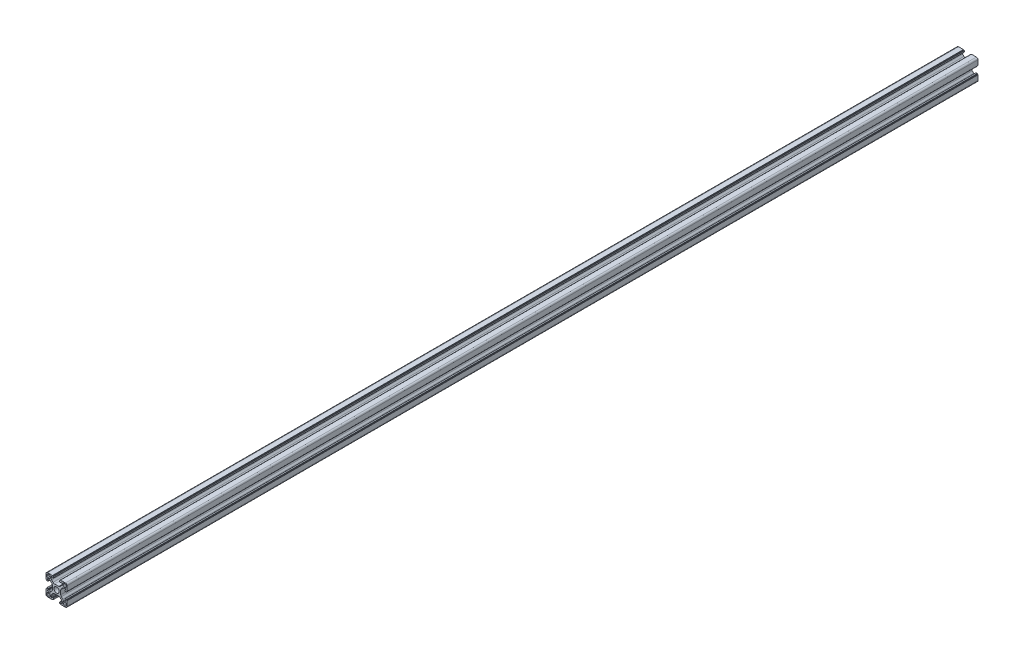
from build123d import *

# Parameters (mm, degrees)
EXTRUDE_1_DEPTH = 865


with BuildPart() as part:
    # Эскиз2 → Бобышка-Вытянуть1 (new body)
    with BuildSketch(Plane.XY):
        with BuildLine():
            Line((0.129852449, 4.683728486), (2.028633118, 4.683728486))
            ThreePointArc((2.028633118, 4.683728486), (2.793999983, 4.835969421), (3.44284668, 5.269514923))
            Line((3.44284668, 5.269514923), (4.744066011, 6.570734254))
            ThreePointArc((4.744066011, 6.570734254), (5.177611514, 7.219580952), (5.329852449, 7.984947817))
            Line((5.329852449, 7.984947817), (5.329852449, 8.883728486))
            ThreePointArc((5.329852449, 8.883728486), (5.183405839, 9.237281876), (4.829852449, 9.383728486))
            Line((4.829852449, 9.383728486), (4.72695923, 9.383728486))
            ThreePointArc((4.72695923, 9.383728486), (4.535617514, 9.345668252), (4.373405839, 9.237281876))
            Line((4.373405839, 9.237281876), (3.893075754, 8.75695179))
            ThreePointArc((3.893075754, 8.75695179), (3.811969916, 8.702758603), (3.716299058, 8.683728486))
            Line((3.716299058, 8.683728486), (3.429852449, 8.683728486))
            ThreePointArc((3.429852449, 8.683728486), (3.253075754, 8.75695179), (3.179852449, 8.933728486))
            Line((3.179852449, 8.933728486), (3.179852449, 10.082799306))
            ThreePointArc((3.179852449, 10.082799306), (3.223786432, 10.188865323), (3.329852449, 10.232799306))
            Line((3.329852449, 10.232799306), (3.829852449, 10.232799306))
            Line((3.829852449, 10.232799306), (3.829852449, 10.533728486))
            ThreePointArc((3.829852449, 10.533728486), (3.873786432, 10.639794503), (3.979852449, 10.683728486))
            Line((3.979852449, 10.683728486), (8.629852449, 10.683728486))
            ThreePointArc((8.629852449, 10.683728486), (9.690512621, 10.244388658), (10.129852449, 9.183728486))
            Line((10.129852449, 9.183728486), (10.129852449, 4.533728486))
            ThreePointArc((10.129852449, 4.533728486), (10.085918466, 4.427662469), (9.979852449, 4.383728486))
            Line((9.979852449, 4.383728486), (9.678923269, 4.383728486))
            Line((9.678923269, 4.383728486), (9.678923269, 3.883728486))
            ThreePointArc((9.678923269, 3.883728486), (9.634989287, 3.777662469), (9.528923269, 3.733728486))
            Line((9.528923269, 3.733728486), (8.379852449, 3.733728486))
            ThreePointArc((8.379852449, 3.733728486), (8.203075754, 3.80695179), (8.129852449, 3.983728486))
            Line((8.129852449, 3.983728486), (8.129852449, 4.270175095))
            ThreePointArc((8.129852449, 4.270175095), (8.148882566, 4.365845953), (8.203075754, 4.44695179))
            Line((8.203075754, 4.44695179), (8.683405839, 4.927281876))
            ThreePointArc((8.683405839, 4.927281876), (8.791792215, 5.089493551), (8.829852449, 5.280835267))
            Line((8.829852449, 5.280835267), (8.829852449, 5.383728486))
            ThreePointArc((8.829852449, 5.383728486), (8.683405839, 5.737281876), (8.329852449, 5.883728486))
            Line((8.329852449, 5.883728486), (7.43107178, 5.883728486))
            ThreePointArc((7.43107178, 5.883728486), (6.665704915, 5.731487551), (6.016858217, 5.297942048))
            Line((6.016858217, 5.297942048), (4.715638886, 3.996722717))
            ThreePointArc((4.715638886, 3.996722717), (4.282093384, 3.34787602), (4.129852449, 2.582509155))
            Line((4.129852449, 2.582509155), (4.129852449, 0.683728486))
            Line((4.129852449, 0.683728486), (4.129852449, -1.215052183))
            ThreePointArc((4.129852449, -1.215052183), (4.282093384, -1.980419048), (4.715638886, -2.629265746))
            Line((4.715638886, -2.629265746), (6.016858217, -3.930485077))
            ThreePointArc((6.016858217, -3.930485077), (6.665704915, -4.364030579), (7.43107178, -4.516271514))
            Line((7.43107178, -4.516271514), (8.329852449, -4.516271514))
            ThreePointArc((8.329852449, -4.516271514), (8.683405839, -4.369824905), (8.829852449, -4.016271514))
            Line((8.829852449, -4.016271514), (8.829852449, -3.913378295))
            ThreePointArc((8.829852449, -3.913378295), (8.791792215, -3.722036579), (8.683405839, -3.559824905))
            Line((8.683405839, -3.559824905), (8.203075754, -3.079494819))
            ThreePointArc((8.203075754, -3.079494819), (8.148882566, -2.998388982), (8.129852449, -2.902718124))
            Line((8.129852449, -2.902718124), (8.129852449, -2.616271514))
            ThreePointArc((8.129852449, -2.616271514), (8.203075754, -2.439494819), (8.379852449, -2.366271514))
            Line((8.379852449, -2.366271514), (9.528923269, -2.366271514))
            ThreePointArc((9.528923269, -2.366271514), (9.634989287, -2.410205497), (9.678923269, -2.516271514))
            Line((9.678923269, -2.516271514), (9.678923269, -3.016271514))
            Line((9.678923269, -3.016271514), (9.979852449, -3.016271514))
            ThreePointArc((9.979852449, -3.016271514), (10.085918466, -3.060205497), (10.129852449, -3.166271514))
            Line((10.129852449, -3.166271514), (10.129852449, -7.816271514))
            ThreePointArc((10.129852449, -7.816271514), (9.690512621, -8.876931686), (8.629852449, -9.316271514))
            Line((8.629852449, -9.316271514), (3.979852449, -9.316271514))
            ThreePointArc((3.979852449, -9.316271514), (3.873786432, -9.272337531), (3.829852449, -9.166271514))
            Line((3.829852449, -9.166271514), (3.829852449, -8.865342335))
            Line((3.829852449, -8.865342335), (3.329852449, -8.865342335))
            ThreePointArc((3.329852449, -8.865342335), (3.223786432, -8.821408352), (3.179852449, -8.715342335))
            Line((3.179852449, -8.715342335), (3.179852449, -7.566271514))
            ThreePointArc((3.179852449, -7.566271514), (3.253075754, -7.389494819), (3.429852449, -7.316271514))
            Line((3.429852449, -7.316271514), (3.716299058, -7.316271514))
            ThreePointArc((3.716299058, -7.316271514), (3.811969916, -7.335301631), (3.893075754, -7.389494819))
            Line((3.893075754, -7.389494819), (4.373405839, -7.869824905))
            ThreePointArc((4.373405839, -7.869824905), (4.535617514, -7.978211281), (4.72695923, -8.016271514))
            Line((4.72695923, -8.016271514), (4.829852449, -8.016271514))
            ThreePointArc((4.829852449, -8.016271514), (5.183405839, -7.869824905), (5.329852449, -7.516271514))
            Line((5.329852449, -7.516271514), (5.329852449, -6.617490845))
            ThreePointArc((5.329852449, -6.617490845), (5.177611514, -5.85212398), (4.744066011, -5.203277283))
            Line((4.744066011, -5.203277283), (3.44284668, -3.902057952))
            ThreePointArc((3.44284668, -3.902057952), (2.793999983, -3.468512449), (2.028633118, -3.316271514))
            Line((2.028633118, -3.316271514), (0.129852449, -3.316271514))
            Line((0.129852449, -3.316271514), (-1.76892822, -3.316271514))
            ThreePointArc((-1.76892822, -3.316271514), (-2.534295085, -3.468512449), (-3.183141783, -3.902057952))
            Line((-3.183141783, -3.902057952), (-4.484361114, -5.203277283))
            ThreePointArc((-4.484361114, -5.203277283), (-4.917906616, -5.85212398), (-5.070147551, -6.617490845))
            Line((-5.070147551, -6.617490845), (-5.070147551, -7.516271514))
            ThreePointArc((-5.070147551, -7.516271514), (-4.923700942, -7.869824905), (-4.570147551, -8.016271514))
            Line((-4.570147551, -8.016271514), (-4.467254332, -8.016271514))
            ThreePointArc((-4.467254332, -8.016271514), (-4.275912616, -7.978211281), (-4.113700942, -7.869824905))
            Line((-4.113700942, -7.869824905), (-3.633370856, -7.389494819))
            ThreePointArc((-3.633370856, -7.389494819), (-3.552265019, -7.335301631), (-3.456594161, -7.316271514))
            Line((-3.456594161, -7.316271514), (-3.170147551, -7.316271514))
            ThreePointArc((-3.170147551, -7.316271514), (-2.993370856, -7.389494819), (-2.920147551, -7.566271514))
            Line((-2.920147551, -7.566271514), (-2.920147551, -8.715342335))
            ThreePointArc((-2.920147551, -8.715342335), (-2.964081534, -8.821408352), (-3.070147551, -8.865342335))
            Line((-3.070147551, -8.865342335), (-3.570147551, -8.865342335))
            Line((-3.570147551, -8.865342335), (-3.570147551, -9.166271514))
            ThreePointArc((-3.570147551, -9.166271514), (-3.614081534, -9.272337531), (-3.720147551, -9.316271514))
            Line((-3.720147551, -9.316271514), (-8.370147551, -9.316271514))
            ThreePointArc((-8.370147551, -9.316271514), (-9.430807723, -8.876931686), (-9.870147551, -7.816271514))
            Line((-9.870147551, -7.816271514), (-9.870147551, -3.166271514))
            ThreePointArc((-9.870147551, -3.166271514), (-9.826213568, -3.060205497), (-9.720147551, -3.016271514))
            Line((-9.720147551, -3.016271514), (-9.419218372, -3.016271514))
            Line((-9.419218372, -3.016271514), (-9.419218372, -2.516271514))
            ThreePointArc((-9.419218372, -2.516271514), (-9.375284389, -2.410205497), (-9.269218372, -2.366271514))
            Line((-9.269218372, -2.366271514), (-8.120147551, -2.366271514))
            ThreePointArc((-8.120147551, -2.366271514), (-7.943370856, -2.439494819), (-7.870147551, -2.616271514))
            Line((-7.870147551, -2.616271514), (-7.870147551, -2.902718124))
            ThreePointArc((-7.870147551, -2.902718124), (-7.889177668, -2.998388982), (-7.943370856, -3.079494819))
            Line((-7.943370856, -3.079494819), (-8.423700942, -3.559824905))
            ThreePointArc((-8.423700942, -3.559824905), (-8.532087317, -3.722036579), (-8.570147551, -3.913378295))
            Line((-8.570147551, -3.913378295), (-8.570147551, -4.016271514))
            ThreePointArc((-8.570147551, -4.016271514), (-8.423700942, -4.369824905), (-8.070147551, -4.516271514))
            Line((-8.070147551, -4.516271514), (-7.171366882, -4.516271514))
            ThreePointArc((-7.171366882, -4.516271514), (-6.406000017, -4.364030579), (-5.75715332, -3.930485077))
            Line((-5.75715332, -3.930485077), (-4.455933989, -2.629265746))
            ThreePointArc((-4.455933989, -2.629265746), (-4.022388486, -1.980419048), (-3.870147551, -1.215052183))
            Line((-3.870147551, -1.215052183), (-3.870147551, 0.683728486))
            Line((-3.870147551, 0.683728486), (-3.870147551, 2.582509155))
            ThreePointArc((-3.870147551, 2.582509155), (-4.022388486, 3.34787602), (-4.455933989, 3.996722717))
            Line((-4.455933989, 3.996722717), (-5.75715332, 5.297942048))
            ThreePointArc((-5.75715332, 5.297942048), (-6.406000017, 5.731487551), (-7.171366882, 5.883728486))
            Line((-7.171366882, 5.883728486), (-8.070147551, 5.883728486))
            ThreePointArc((-8.070147551, 5.883728486), (-8.423700942, 5.737281876), (-8.570147551, 5.383728486))
            Line((-8.570147551, 5.383728486), (-8.570147551, 5.280835267))
            ThreePointArc((-8.570147551, 5.280835267), (-8.532087317, 5.089493551), (-8.423700942, 4.927281876))
            Line((-8.423700942, 4.927281876), (-7.943370856, 4.44695179))
            ThreePointArc((-7.943370856, 4.44695179), (-7.889177668, 4.365845953), (-7.870147551, 4.270175095))
            Line((-7.870147551, 4.270175095), (-7.870147551, 3.983728486))
            ThreePointArc((-7.870147551, 3.983728486), (-7.943370856, 3.80695179), (-8.120147551, 3.733728486))
            Line((-8.120147551, 3.733728486), (-9.269218372, 3.733728486))
            ThreePointArc((-9.269218372, 3.733728486), (-9.375284389, 3.777662469), (-9.419218372, 3.883728486))
            Line((-9.419218372, 3.883728486), (-9.419218372, 4.383728486))
            Line((-9.419218372, 4.383728486), (-9.720147551, 4.383728486))
            ThreePointArc((-9.720147551, 4.383728486), (-9.826213568, 4.427662469), (-9.870147551, 4.533728486))
            Line((-9.870147551, 4.533728486), (-9.870147551, 9.183728486))
            ThreePointArc((-9.870147551, 9.183728486), (-9.430807723, 10.244388658), (-8.370147551, 10.683728486))
            Line((-8.370147551, 10.683728486), (-3.720147551, 10.683728486))
            ThreePointArc((-3.720147551, 10.683728486), (-3.614081534, 10.639794503), (-3.570147551, 10.533728486))
            Line((-3.570147551, 10.533728486), (-3.570147551, 10.232799306))
            Line((-3.570147551, 10.232799306), (-3.070147551, 10.232799306))
            ThreePointArc((-3.070147551, 10.232799306), (-2.964081534, 10.188865323), (-2.920147551, 10.082799306))
            Line((-2.920147551, 10.082799306), (-2.920147551, 8.933728486))
            ThreePointArc((-2.920147551, 8.933728486), (-2.993370856, 8.75695179), (-3.170147551, 8.683728486))
            Line((-3.170147551, 8.683728486), (-3.456594161, 8.683728486))
            ThreePointArc((-3.456594161, 8.683728486), (-3.552265019, 8.702758603), (-3.633370856, 8.75695179))
            Line((-3.633370856, 8.75695179), (-4.113700942, 9.237281876))
            ThreePointArc((-4.113700942, 9.237281876), (-4.275912616, 9.345668252), (-4.467254332, 9.383728486))
            Line((-4.467254332, 9.383728486), (-4.570147551, 9.383728486))
            ThreePointArc((-4.570147551, 9.383728486), (-4.923700942, 9.237281876), (-5.070147551, 8.883728486))
            Line((-5.070147551, 8.883728486), (-5.070147551, 7.984947817))
            ThreePointArc((-5.070147551, 7.984947817), (-4.917906616, 7.219580952), (-4.484361114, 6.570734254))
            Line((-4.484361114, 6.570734254), (-3.183141783, 5.269514923))
            ThreePointArc((-3.183141783, 5.269514923), (-2.534295085, 4.835969421), (-1.76892822, 4.683728486))
            Line((-1.76892822, 4.683728486), (0.129852449, 4.683728486))
        make_face()
        with BuildLine():
            Line((7.029852449, 6.783728486), (8.429852449, 6.783728486))
            ThreePointArc((8.429852449, 6.783728486), (8.995537874, 7.018043061), (9.229852449, 7.583728486))
            Line((9.229852449, 7.583728486), (9.229852449, 8.983728486))
            ThreePointArc((9.229852449, 8.983728486), (8.995537874, 9.549413911), (8.429852449, 9.783728486))
            Line((8.429852449, 9.783728486), (7.029852449, 9.783728486))
            ThreePointArc((7.029852449, 9.783728486), (6.464167024, 9.549413911), (6.229852449, 8.983728486))
            Line((6.229852449, 8.983728486), (6.229852449, 7.583728486))
            ThreePointArc((6.229852449, 7.583728486), (6.464167024, 7.018043061), (7.029852449, 6.783728486))
        make_face(mode=Mode.SUBTRACT)
        with BuildLine():
            Line((6.229852449, -6.216271514), (6.229852449, -7.616271514))
            ThreePointArc((6.229852449, -7.616271514), (6.464167024, -8.181956939), (7.029852449, -8.416271514))
            Line((7.029852449, -8.416271514), (8.429852449, -8.416271514))
            ThreePointArc((8.429852449, -8.416271514), (8.995537874, -8.181956939), (9.229852449, -7.616271514))
            Line((9.229852449, -7.616271514), (9.229852449, -6.216271514))
            ThreePointArc((9.229852449, -6.216271514), (8.995537874, -5.650586089), (8.429852449, -5.416271514))
            Line((8.429852449, -5.416271514), (7.029852449, -5.416271514))
            ThreePointArc((7.029852449, -5.416271514), (6.464167024, -5.650586089), (6.229852449, -6.216271514))
        make_face(mode=Mode.SUBTRACT)
        with BuildLine():
            Line((-6.770147551, -5.416271514), (-8.170147551, -5.416271514))
            ThreePointArc((-8.170147551, -5.416271514), (-8.735832976, -5.650586089), (-8.970147551, -6.216271514))
            Line((-8.970147551, -6.216271514), (-8.970147551, -7.616271514))
            ThreePointArc((-8.970147551, -7.616271514), (-8.735832976, -8.181956939), (-8.170147551, -8.416271514))
            Line((-8.170147551, -8.416271514), (-6.770147551, -8.416271514))
            ThreePointArc((-6.770147551, -8.416271514), (-6.204462126, -8.181956939), (-5.970147551, -7.616271514))
            Line((-5.970147551, -7.616271514), (-5.970147551, -6.216271514))
            ThreePointArc((-5.970147551, -6.216271514), (-6.204462126, -5.650586089), (-6.770147551, -5.416271514))
        make_face(mode=Mode.SUBTRACT)
        with BuildLine():
            Line((-5.970147551, 7.583728486), (-5.970147551, 8.983728486))
            ThreePointArc((-5.970147551, 8.983728486), (-6.204462126, 9.549413911), (-6.770147551, 9.783728486))
            Line((-6.770147551, 9.783728486), (-8.170147551, 9.783728486))
            ThreePointArc((-8.170147551, 9.783728486), (-8.735832976, 9.549413911), (-8.970147551, 8.983728486))
            Line((-8.970147551, 8.983728486), (-8.970147551, 7.583728486))
            ThreePointArc((-8.970147551, 7.583728486), (-8.735832976, 7.018043061), (-8.170147551, 6.783728486))
            Line((-8.170147551, 6.783728486), (-6.770147551, 6.783728486))
            ThreePointArc((-6.770147551, 6.783728486), (-6.204462126, 7.018043061), (-5.970147551, 7.583728486))
        make_face(mode=Mode.SUBTRACT)
        with BuildLine():
            ThreePointArc((2.629852449, 0.683728486), (1.897619402, 2.451495439), (0.129852449, 3.183728486))
            ThreePointArc((0.129852449, 3.183728486), (-1.637914504, 2.451495439), (-2.370147551, 0.683728486))
            ThreePointArc((-2.370147551, 0.683728486), (-1.637914504, -1.084038467), (0.129852449, -1.816271514))
            ThreePointArc((0.129852449, -1.816271514), (1.897619402, -1.084038467), (2.629852449, 0.683728486))
        make_face(mode=Mode.SUBTRACT)
    extrude(amount=EXTRUDE_1_DEPTH)


solid = part.part
